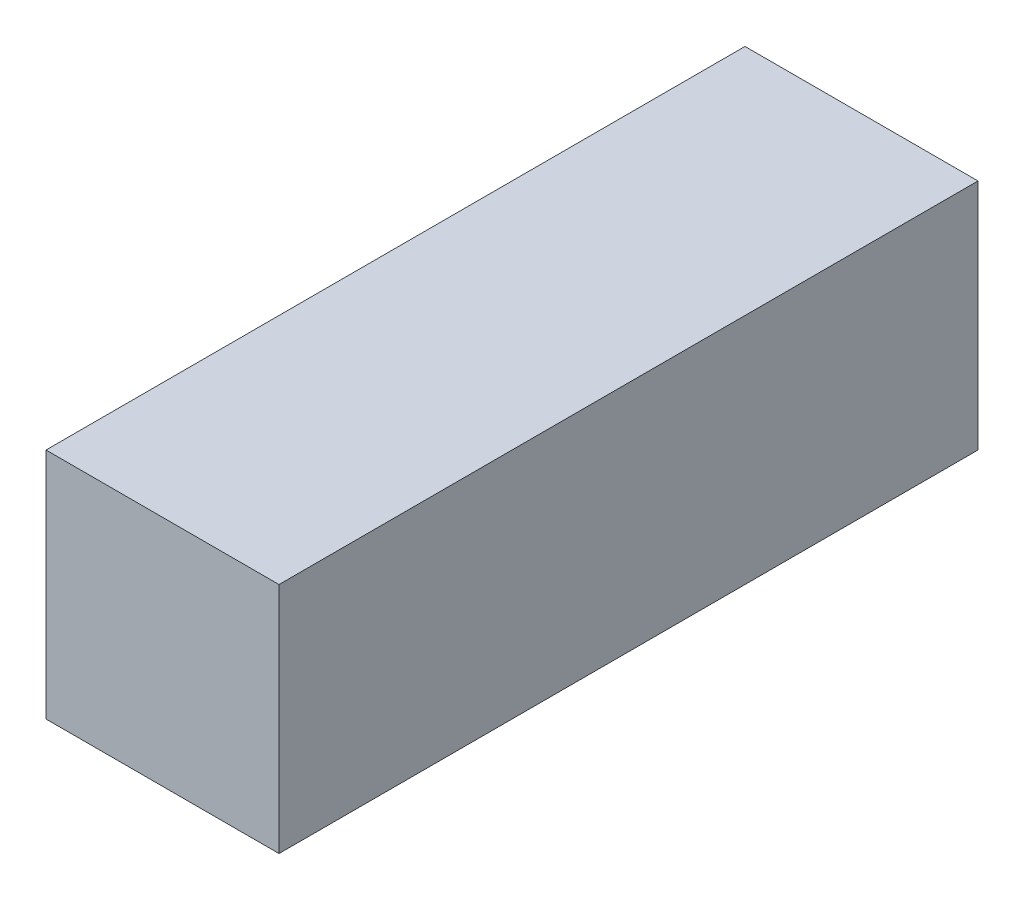
from build123d import *

# Parameters (mm, degrees)
SKETCH2_W           = 100
SKETCH2_H           = 100
BOSS_EXTRUDE1_DEPTH = 300


with BuildPart() as part:
    # Sketch2 → Boss-Extrude1 (new body)
    with BuildSketch(Plane.XY):
        with Locations((8.278145695, -23.509933775)):
            Rectangle(SKETCH2_W, SKETCH2_H)
    extrude(amount=BOSS_EXTRUDE1_DEPTH)


solid = part.part
